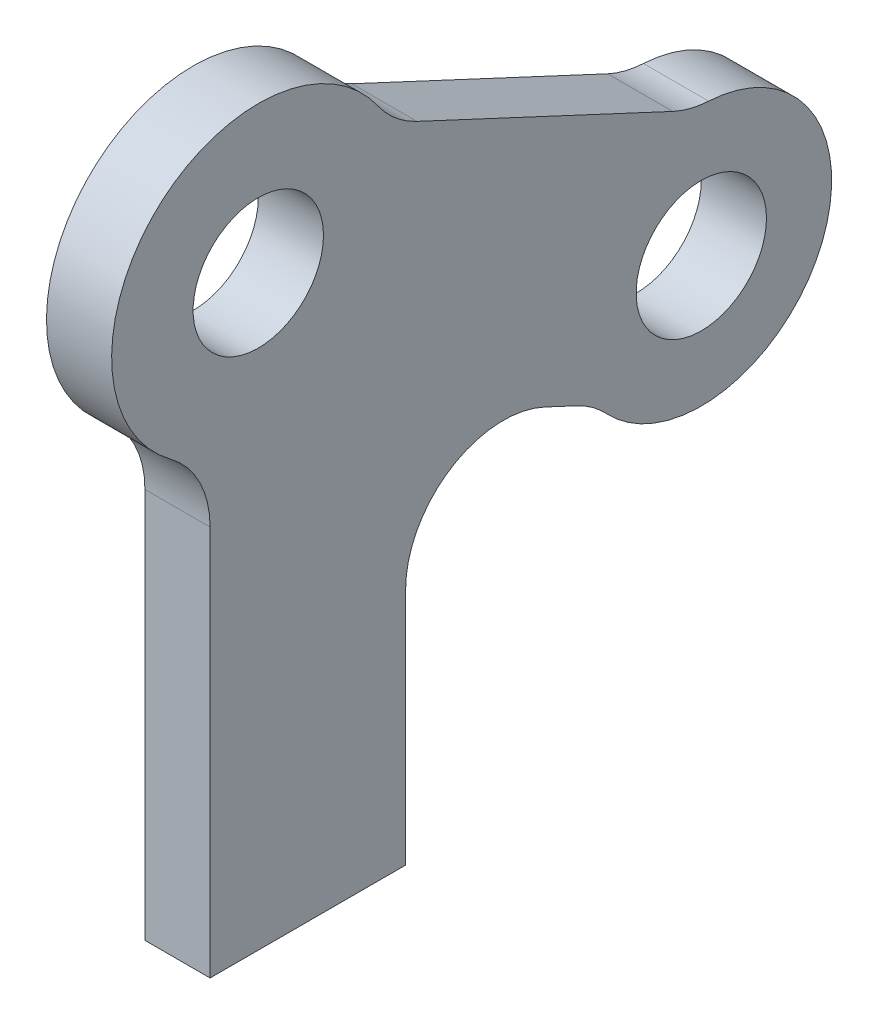
from build123d import *

# Parameters (mm, degrees)
EXTRUDE_1_DEPTH          = 2
CUT_EXTRUDE_3_DEPTH      = 26.250159218
CUT_EXTRUDE_3_DEPTH_BACK = 26.250159218
SKETCH_1_3_R             = 2
FILLET_1_R               = 3


with BuildPart() as part:
    # 草图1 → 凸台-拉伸1 (new body)
    with BuildSketch(Plane(origin=(0, 0, 0), x_dir=(0, 0, -1), z_dir=(1, 0, 0))):
        with BuildLine():
            Line((1.479163916, 3.172077255), (-1.479163916, -3.172077255))
            Line((-1.479163916, -3.172077255), (3.19185305, -3.172077255))
            ThreePointArc((3.19185305, -3.172077255), (4.160128527, -1.715613779), (4.5, 0))
            ThreePointArc((4.5, 0), (4.384156276, 1.014482011), (4.042589444, 1.9767323))
            Line((4.042589444, 1.9767323), (1.479163916, 3.172077255))
        make_face()
        with BuildLine():
            Line((1.084261612, -4.36742221), (-1.479163916, -3.172077255))
            Line((-1.479163916, -3.172077255), (-1.479163916, -4.249949895))
            ThreePointArc((-1.479163916, -4.249949895), (-0.206002169, -4.495282317), (1.084261612, -4.36742221))
        make_face()
        with BuildLine():
            Line((3.19185305, -3.172077255), (-1.479163916, -3.172077255))
            Line((-1.479163916, -3.172077255), (1.084261612, -4.36742221))
            ThreePointArc((1.084261612, -4.36742221), (2.220022869, -3.914268573), (3.19185305, -3.172077255))
        make_face()
        with BuildLine():
            Line((-1.479163916, -4.249949895), (-1.479163916, -3.172077255))
            Line((-1.479163916, -3.172077255), (1.479163916, 3.172077255))
            Line((1.479163916, 3.172077255), (4.042589444, 1.9767323))
            ThreePointArc((4.042589444, 1.9767323), (-3.366850219, 2.985685784), (-1.479163916, -4.249949895))
        make_face()
        with BuildLine():
            ThreePointArc((4.5, 0), (4.160128527, -1.715613779), (3.19185305, -3.172077255))
            Line((3.19185305, -3.172077255), (4.520836084, -3.172077255))
            Line((4.520836084, -3.172077255), (4.520836084, -5.969923204))
            Line((4.520836084, -5.969923204), (10.360395407, -8.692954436))
            ThreePointArc((10.360395407, -8.692954436), (9.969385657, -4.648800879), (13.318723239, -2.348799927))
            Line((13.318723239, -2.348799927), (4.042589444, 1.9767323))
            ThreePointArc((4.042589444, 1.9767323), (4.384156276, 1.014482011), (4.5, 0))
        make_face()
        with BuildLine():
            Line((4.520836084, -3.172077255), (3.19185305, -3.172077255))
            ThreePointArc((3.19185305, -3.172077255), (2.220022869, -3.914268573), (1.084261612, -4.36742221))
            Line((1.084261612, -4.36742221), (4.520836084, -5.969923204))
            Line((4.520836084, -5.969923204), (4.520836084, -3.172077255))
        make_face()
        with BuildLine():
            ThreePointArc((1.084261612, -4.36742221), (-0.206002169, -4.495282317), (-1.479163916, -4.249949895))
            Line((-1.479163916, -4.249949895), (-1.479163916, -18))
            Line((-1.479163916, -18), (4.520836084, -18))
            Line((4.520836084, -18), (4.520836084, -5.969923204))
            Line((4.520836084, -5.969923204), (1.084261612, -4.36742221))
        make_face()
        with BuildLine():
            ThreePointArc((17.594616806, -6.339273926), (16.323758221, -3.414930045), (13.318723239, -2.348799927))
            Line((13.318723239, -2.348799927), (15.073780722, -3.167196671))
            Line((15.073780722, -3.167196671), (12.115452889, -9.511351181))
            Line((12.115452889, -9.511351181), (10.360395407, -8.692954436))
            ThreePointArc((10.360395407, -8.692954436), (14.832177795, -10.143014558), (17.594616806, -6.339273926))
        make_face()
        with BuildLine():
            Line((15.073780722, -3.167196671), (13.318723239, -2.348799927))
            ThreePointArc((13.318723239, -2.348799927), (9.969385657, -4.648800879), (10.360395407, -8.692954436))
            Line((10.360395407, -8.692954436), (12.115452889, -9.511351181))
            Line((12.115452889, -9.511351181), (15.073780722, -3.167196671))
        make_face()
    extrude(amount=EXTRUDE_1_DEPTH)

    # 草图1<3> → 切除-拉伸3 (cut, two sides: drawn at the far end of the back side and taken through both)
    with BuildSketch(Plane(origin=(0, 0, 0), x_dir=(0, 0, -1), z_dir=(1, 0, 0)).offset(-CUT_EXTRUDE_3_DEPTH_BACK)):
        Circle(SKETCH_1_3_R)
        with Locations((13.594616806, -6.339273926)):
            Circle(SKETCH_1_3_R)
    extrude(amount=CUT_EXTRUDE_3_DEPTH + CUT_EXTRUDE_3_DEPTH_BACK, mode=Mode.SUBTRACT)

    # 圆角1
    fillet_1_edges = [part.edges().sort_by_distance(p)[0] for p in [
        (1, -4.249949895, 1.479163916),
        (1, 1.9767323, -4.042589444),
        (1, -5.969923204, -4.520836084),
        (1, -8.692954436, -10.360395407),
        (1, -2.348799927, -13.318723239),
    ]]
    fillet(fillet_1_edges, radius=FILLET_1_R)


solid = part.part
